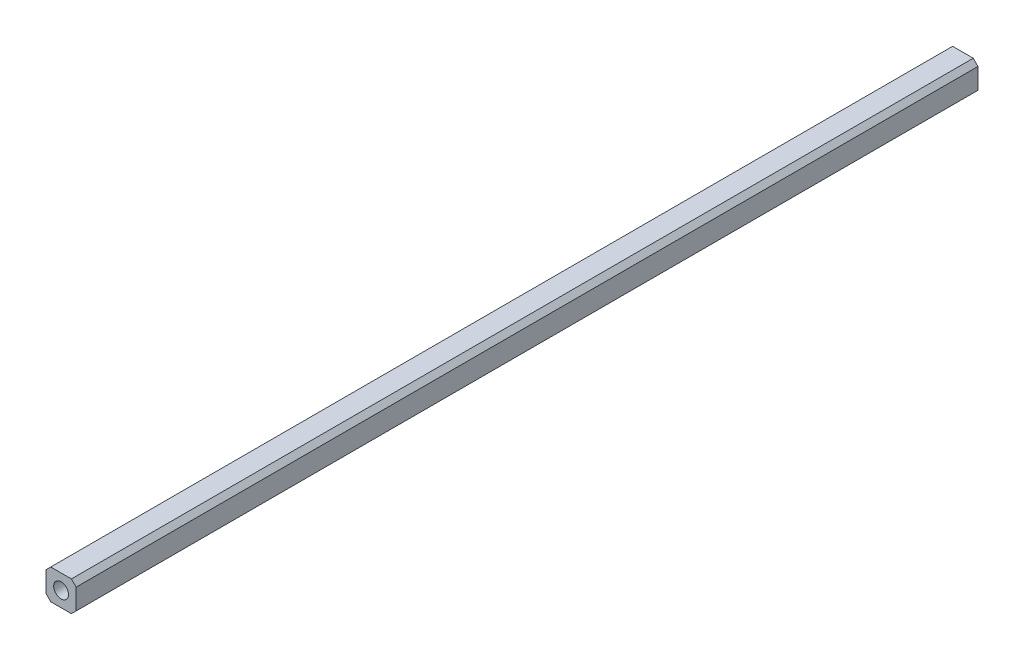
from build123d import *

# Parameters (mm, degrees)
SKETCH1_W           = 12.7
SKETCH1_H           = 12.7
BOSS_EXTRUDE1_DEPTH = 190
SKETCH2_R           = 3.125
CUT_EXTRUDE1_DEPTH  = 10
CHAMFER1_SIZE       = 2


with BuildPart() as part:
    # Sketch1 → Boss-Extrude1 (new, symmetric)
    with BuildSketch(Plane.XY):
        Rectangle(SKETCH1_W, SKETCH1_H)
    extrude(amount=BOSS_EXTRUDE1_DEPTH, both=True)

    # Sketch2 → Cut-Extrude1 (cut)
    with BuildSketch(Plane.XY.offset(190)):
        Circle(SKETCH2_R)
    extrude(amount=-CUT_EXTRUDE1_DEPTH, mode=Mode.SUBTRACT)

    # Chamfer1
    chamfer1_edges = [part.edges().sort_by_distance(p)[0] for p in [
        (-6.35, 6.35, 0),
        (-6.35, -6.35, 0),
        (6.35, -6.35, 0),
        (6.35, 6.35, 0),
    ]]
    chamfer(chamfer1_edges, length=CHAMFER1_SIZE)


solid = part.part
